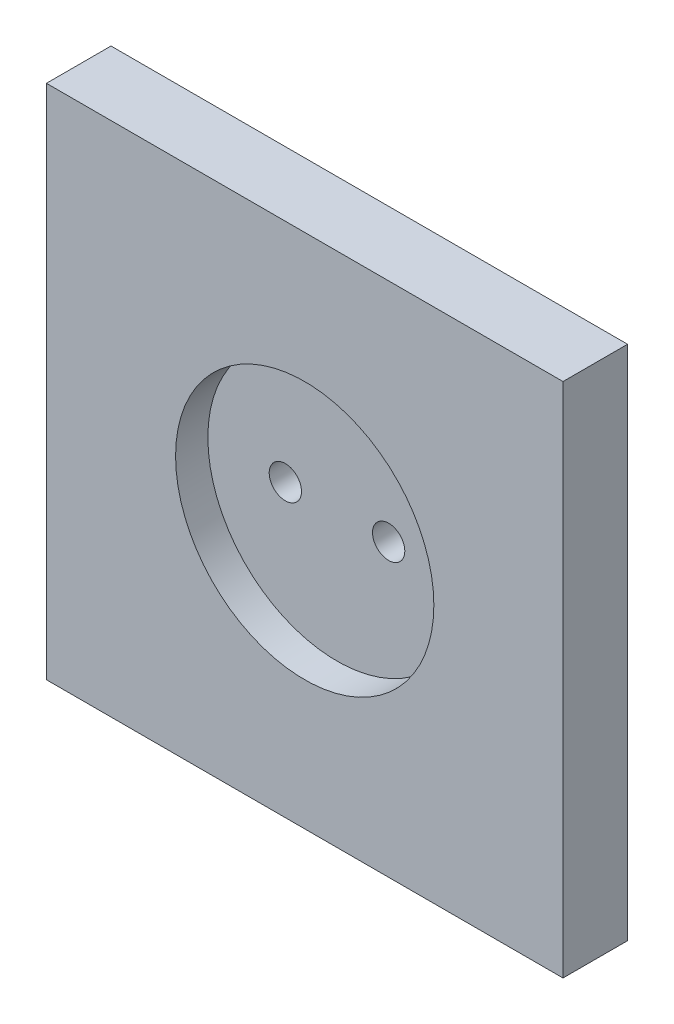
from build123d import *

# Parameters (mm, degrees)
SKETCH_1_W          = 80
SKETCH_1_H          = 80
EXTRUDE_1_DEPTH     = 10
SKETCH_2_R          = 20
CUT_EXTRUDE_1_DEPTH = 5
SKETCH_3_R          = 2.5
CUT_EXTRUDE_2_DEPTH = 5


with BuildPart() as part:
    # Эскиз1 → Бобышка-Вытянуть1 (new body)
    with BuildSketch(Plane.XY):
        with Locations((40, 40)):
            Rectangle(SKETCH_1_W, SKETCH_1_H)
    extrude(amount=EXTRUDE_1_DEPTH)

    # Эскиз2 → Вырез-Вытянуть1 (cut)
    with BuildSketch(Plane.XY.offset(10)):
        with Locations((40, 40)):
            Circle(SKETCH_2_R)
    extrude(amount=-CUT_EXTRUDE_1_DEPTH, mode=Mode.SUBTRACT)

    # Эскиз3 → Вырез-Вытянуть2 (cut)
    with BuildSketch(Plane.XY.offset(5)):
        with Locations((32, 40)):
            Circle(SKETCH_3_R)
        with Locations((48, 40)):
            Circle(SKETCH_3_R)
    extrude(amount=-CUT_EXTRUDE_2_DEPTH, mode=Mode.SUBTRACT)


solid = part.part
